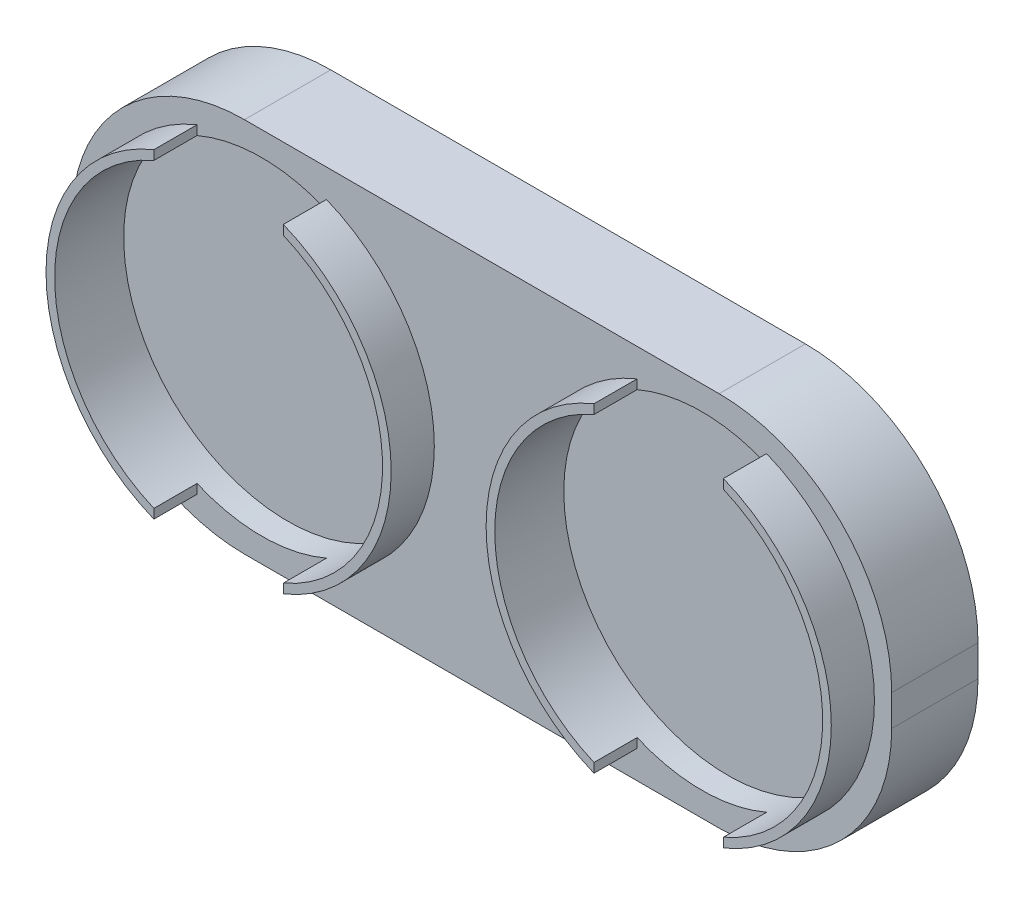
from build123d import *

# Parameters (mm, degrees)
SKETCH1_W           = 43.6
SKETCH1_H           = 95
BOSS_EXTRUDE1_DEPTH = 10
SKETCH2_R           = 3.9
BOSS_EXTRUDE2_DEPTH = 4
SKETCH5_R           = 20
SKETCH5_R_2         = 19
BOSS_EXTRUDE4_DEPTH = 5
SKETCH6_W           = 15
SKETCH6_H           = 43.6
CUT_EXTRUDE1_DEPTH  = 5
FILLET1_R           = 20
CUT_EXTRUDE2_START  = -3
SKETCH7_R           = 19
CUT_EXTRUDE2_DEPTH  = 3
LPATTERN1_COUNT     = 2
LPATTERN1_PITCH     = 24.87
LPATTERN1_COL_COUNT = 2
LPATTERN1_COL_PITCH = 24.87
FILLET3_R           = 0.4


with BuildPart() as part:
    # Sketch1 → Boss-Extrude1 (new body)
    with BuildSketch(Plane(origin=(0, 0, 0), x_dir=(0, 1, 0), z_dir=(0, 0, 1))):
        Rectangle(SKETCH1_W, SKETCH1_H)
    extrude(amount=BOSS_EXTRUDE1_DEPTH)

    # Sketch2 → Boss-Extrude2 (add)
    with BuildSketch(Plane(origin=(0, 0, 0), x_dir=(1, 0, 0), z_dir=(0, 0, -1))):
        with Locations(Location((0, 12.45, 0), (0, 0, 180))):
            Circle(SKETCH2_R)
        with Locations(Location((0, -12.45, 0), (0, 0, 180))):
            Circle(SKETCH2_R)
    boss_extrude2 = extrude(amount=BOSS_EXTRUDE2_DEPTH)

    # Sketch5 → Boss-Extrude4 (add)
    # profile 1 of 2: a face of its own
    with BuildSketch(Plane.XY.offset(10)):
        with Locations((-25.5, 0)):
            Circle(SKETCH5_R)
        with Locations((-25.5, 0)):
            Circle(SKETCH5_R_2, mode=Mode.SUBTRACT)
    # profile 2 of 2: a face of its own
    with BuildSketch(Plane.XY.offset(10)):
        with Locations((25.5, 0)):
            Circle(SKETCH5_R)
        with Locations((25.5, 0)):
            Circle(SKETCH5_R_2, mode=Mode.SUBTRACT)
    extrude(amount=BOSS_EXTRUDE4_DEPTH)

    # Sketch6 → Cut-Extrude1 (cut)
    with BuildSketch(Plane.XY.offset(15)):
        with Locations((-25.5, 0)):
            Rectangle(SKETCH6_W, SKETCH6_H)
        with Locations((25.5, 0)):
            Rectangle(SKETCH6_W, SKETCH6_H)
    extrude(amount=-CUT_EXTRUDE1_DEPTH, mode=Mode.SUBTRACT)

    # Fillet1
    fillet1_edges = [part.edges().sort_by_distance(p)[0] for p in [
        (47.5, 21.8, 5),
        (47.5, -21.8, 5),
        (-47.5, -21.8, 5),
        (-47.5, 21.8, 5),
    ]]
    fillet(fillet1_edges, radius=FILLET1_R)

    # Sketch7 → Cut-Extrude2 (cut)
    with BuildSketch(Plane.XY.offset(10).offset(CUT_EXTRUDE2_START)):
        with Locations(Location((-25.5, 0, 0), (0, 0, 246.750437409))):
            Circle(SKETCH7_R)
        with Locations(Location((25.5, 0, 0), (0, 0, 180))):
            Circle(SKETCH7_R)
    extrude(amount=CUT_EXTRUDE2_DEPTH, mode=Mode.SUBTRACT)

    # LPattern1: Boss-Extrude2 ×2
    with Locations(*[(-i * LPATTERN1_PITCH, 0, 0) for i in range(1, LPATTERN1_COUNT)]):
        add(boss_extrude2)

    # LPattern1 col: Boss-Extrude2 ×2
    with Locations(*[(i * LPATTERN1_COL_PITCH, 0, 0) for i in range(1, LPATTERN1_COL_COUNT)]):
        add(boss_extrude2)

    # Fillet3
    fillet3_edges = [part.edges().sort_by_distance(p)[0] for p in [
        (3.9, -12.45, -4),
        (28.77, 12.45, -4),
        (-20.97, -12.45, -4),
        (-20.97, 12.45, -4),
        (28.77, -12.45, -4),
        (3.9, 12.45, -4),
    ]]
    fillet(fillet3_edges, radius=FILLET3_R)


solid = part.part
